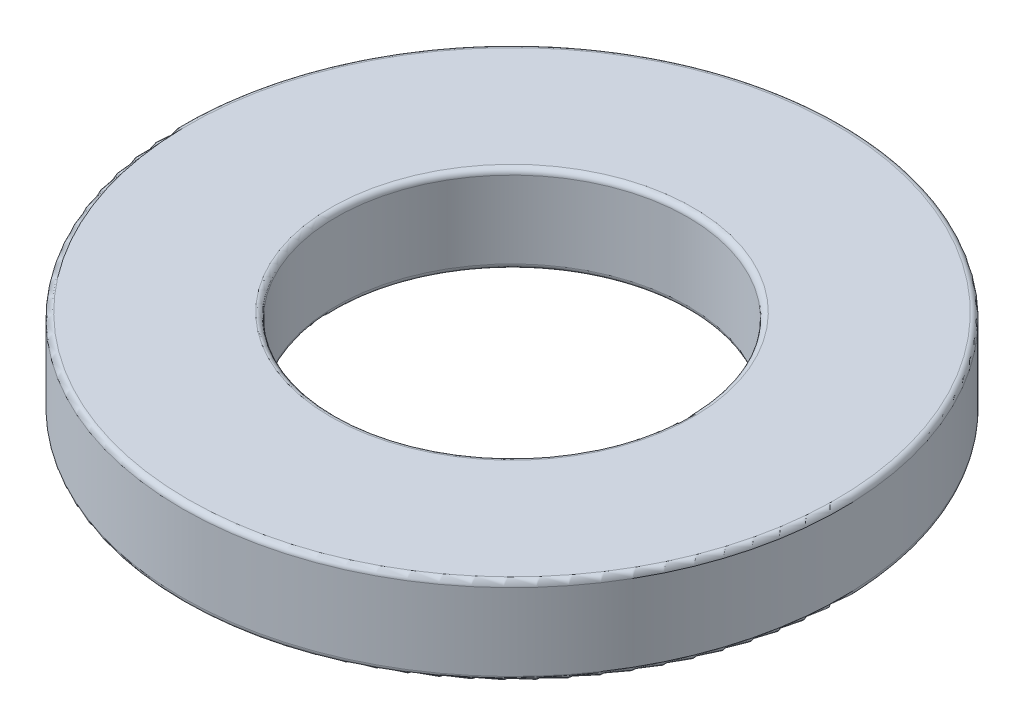
from build123d import *

# Parameters (mm, degrees)
SKETCH1_R           = 6
SKETCH1_R_2         = 3.2
BOSS_EXTRUDE1_DEPTH = 0.8
FILLET1_R           = 0.1


with BuildPart() as part:
    # Sketch1 → Boss-Extrude1 (new, symmetric)
    with BuildSketch(Plane(origin=(0, 0, 0), x_dir=(1, 0, 0), z_dir=(0, 1, 0))):
        with Locations(Location((0, 0, 0), (0, 0, 270))):
            Circle(SKETCH1_R)
        with Locations(Location((0, 0, 0), (0, 0, 270))):
            Circle(SKETCH1_R_2, mode=Mode.SUBTRACT)
    extrude(amount=BOSS_EXTRUDE1_DEPTH, both=True)

    # Fillet1
    fillet1_edges = [part.edges().sort_by_distance(p)[0] for p in [
        (0, -0.8, -6),
        (0, 0.8, -6),
        (0, -0.8, -3.2),
        (0, 0.8, -3.2),
    ]]
    fillet(fillet1_edges, radius=FILLET1_R)


solid = part.part
